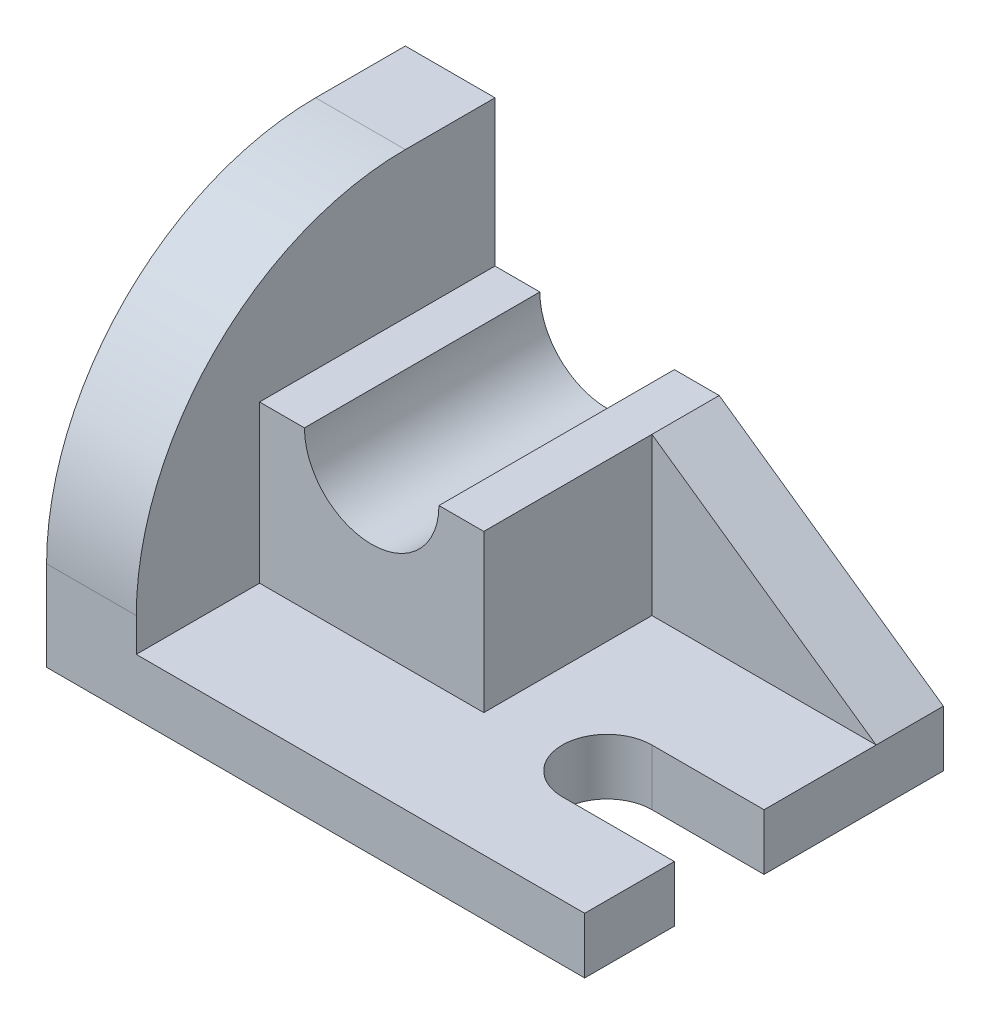
from build123d import *

# Parameters (mm, degrees)
SKETCH2_W           = 96
SKETCH2_H           = 64
BOSS_EXTRUDE1_DEPTH = 10
CUT_EXTRUDE3_DEPTH  = 13
BOSS_EXTRUDE4_DEPTH = 16
SKETCH8_W           = 40
SKETCH8_H           = 42
BOSS_EXTRUDE6_DEPTH = 28
CUT_EXTRUDE4_REACH  = 124.784
SKETCH9_R           = 12
BOSS_EXTRUDE7_DEPTH = 12


with BuildPart() as part:
    # Sketch2 → Boss-Extrude1 (new body)
    with BuildSketch(Plane(origin=(0, 0, 0), x_dir=(1, 0, 0), z_dir=(0, 1, 0))):
        with Locations((48, 32)):
            Rectangle(SKETCH2_W, SKETCH2_H)
    extrude(amount=BOSS_EXTRUDE1_DEPTH)

    # Sketch3 → Cut-Extrude3 (cut)
    with BuildSketch(Plane(origin=(0, 10, 0), x_dir=(1, 0, 0), z_dir=(0, 1, 0))):
        with BuildLine():
            Line((96, 16), (76, 16))
            ThreePointArc((76, 16), (68, 24), (76, 32))
            Line((76, 32), (96, 32))
            ThreePointArc((96, 32), (104, 24), (96, 16))
        make_face()
    extrude(amount=-CUT_EXTRUDE3_DEPTH, mode=Mode.SUBTRACT)

    # Sketch7 → Boss-Extrude4 (add)
    with BuildSketch(Plane.ZY):
        with BuildLine():
            Line((-64, 0), (0, 0))
            Line((0, 0), (0, 16))
            ThreePointArc((0, 16), (-14.058874503, 49.941125497), (-48, 64))
            Line((-48, 64), (-64, 64))
            Line((-64, 64), (-64, 0))
        make_face()
    extrude(amount=-BOSS_EXTRUDE4_DEPTH)

    # Sketch8 → Boss-Extrude6 (add)
    with BuildSketch(Plane(origin=(0, 10, 0), x_dir=(1, 0, 0), z_dir=(0, 1, 0))):
        with Locations((36, 43)):
            Rectangle(SKETCH8_W, SKETCH8_H)
    extrude(amount=BOSS_EXTRUDE6_DEPTH)

    # Sketch9 → Cut-Extrude4 (cut, up to next)
    with BuildSketch(Plane.XY.offset(-22), mode=Mode.PRIVATE) as cut_extrude4_sk1:
        with Locations((36, 38)):
            Circle(SKETCH9_R)
    cut_extrude4_tool1 = extrude(cut_extrude4_sk1.sketch, amount=-CUT_EXTRUDE4_REACH, mode=Mode.PRIVATE) & part.part
    add(cut_extrude4_tool1.solids().sort_by_distance((36, 38, -22))[0], mode=Mode.SUBTRACT)

    # Sketch15 → Boss-Extrude7 (add)
    with BuildSketch(Plane(origin=(0, 0, -64), x_dir=(-1, 0, 0), z_dir=(0, 0, -1))):
        Polygon((-96, 10), (-56, 38), (-56, 10), align=None)
    extrude(amount=-BOSS_EXTRUDE7_DEPTH)


solid = part.part
